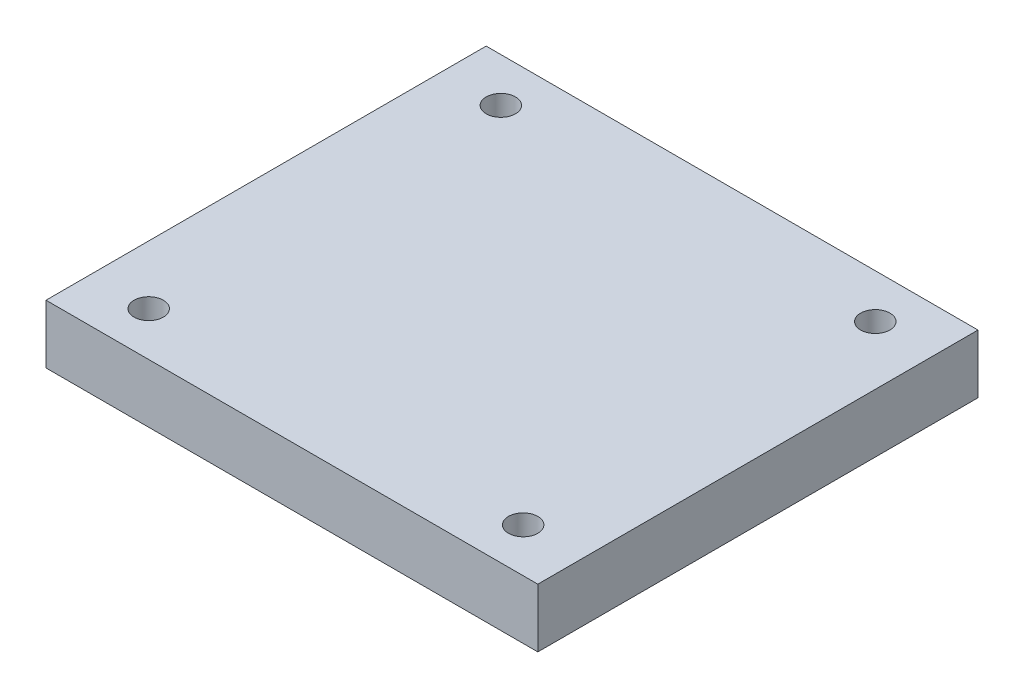
from build123d import *

# Parameters (mm, degrees)
SKETCH1_W           = 106.426
SKETCH1_H           = 95.25
SKETCH1_R           = 3.175
BOSS_EXTRUDE1_DEPTH = 12.7


with BuildPart() as part:
    # Sketch1 → Boss-Extrude1 (new body)
    with BuildSketch(Plane(origin=(0, 0, 0), x_dir=(1, 0, 0), z_dir=(0, 1, 0))):
        Rectangle(SKETCH1_W, SKETCH1_H)
        with Locations(Location((-40.513, 38.1, 0), (0, 0, 270))):
            Circle(SKETCH1_R, mode=Mode.SUBTRACT)
        with Locations(Location((40.513, 38.1, 0), (0, 0, 90))):
            Circle(SKETCH1_R, mode=Mode.SUBTRACT)
        with Locations(Location((40.513, -38.1, 0), (0, 0, 270))):
            Circle(SKETCH1_R, mode=Mode.SUBTRACT)
        with Locations(Location((-40.513, -38.1, 0), (0, 0, 90))):
            Circle(SKETCH1_R, mode=Mode.SUBTRACT)
    extrude(amount=BOSS_EXTRUDE1_DEPTH)


solid = part.part
